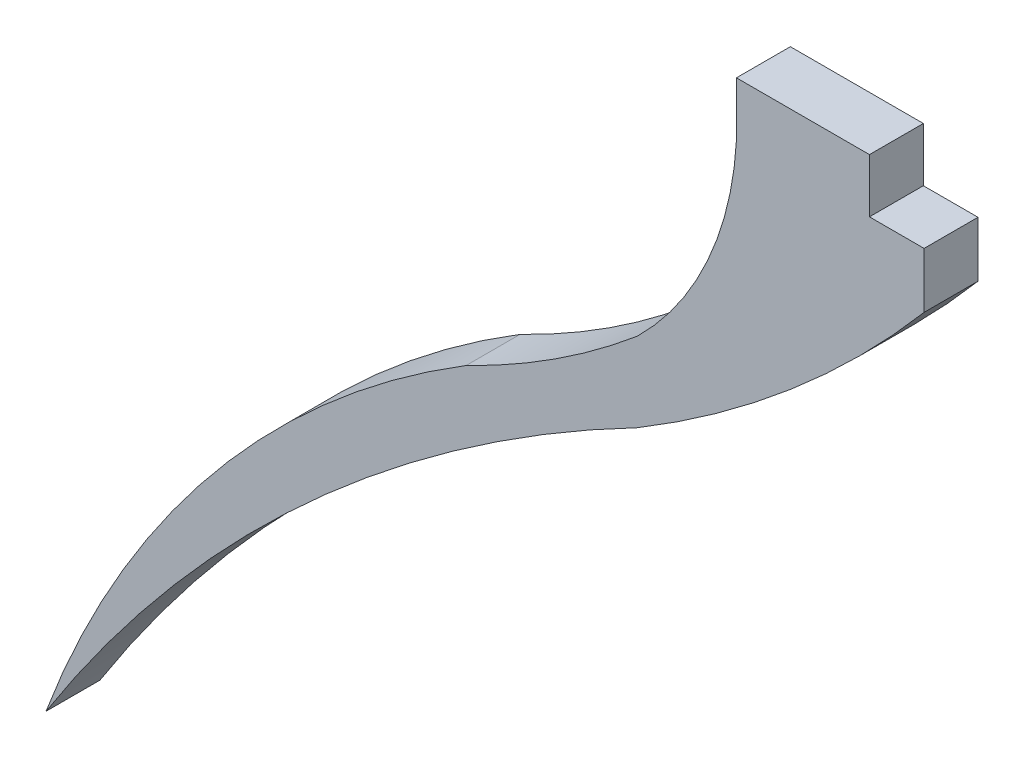
from build123d import *

# Parameters (mm, degrees)
BOSS_EXTRUDE1_DEPTH = 1.524


with BuildPart() as part:
    # Sketch1 → Boss-Extrude1 (new body)
    with BuildSketch(Plane.XY):
        with BuildLine():
            Line((1.507959842, 1.524), (1.507959842, 0))
            Line((1.507959842, 0), (3.052407177, 0))
            Line((3.052407177, 0), (3.052407177, -1.566256329))
            ThreePointArc((3.052407177, -1.566256329), (-0.719055485, -5.336831222), (-5.053668942, -8.443644993))
            ThreePointArc((-5.053668942, -8.443644993), (-14.427584678, -14.984368639), (-21.770031842, -23.744496018))
            ThreePointArc((-21.770031842, -23.744496018), (-17.037991297, -15.548436862), (-9.89443504, -9.340603312))
            ThreePointArc((-9.89443504, -9.340603312), (-7.376811542, -7.92151996), (-5.053668942, -6.202440528))
            ThreePointArc((-5.053668942, -6.202440528), (-3.071218913, -3.363942956), (-2.252033724, 0))
            Line((-2.252033724, 0), (-2.252033724, 1.524))
            Line((-2.252033724, 1.524), (1.507959842, 1.524))
        make_face()
    extrude(amount=BOSS_EXTRUDE1_DEPTH)


solid = part.part
